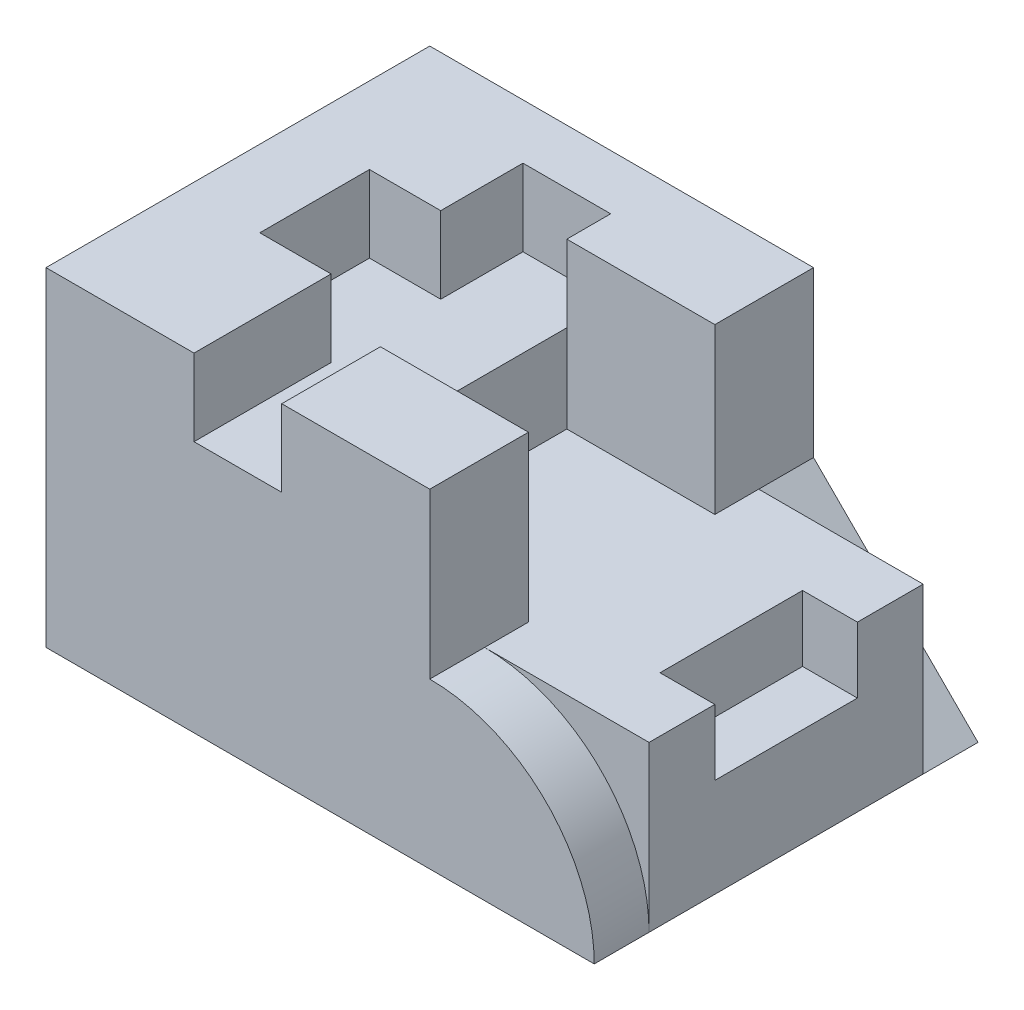
from build123d import *

# Parameters (mm, degrees)
SKETCH_1_W          = 50
SKETCH_1_H          = 30
EXTRUDE_1_DEPTH     = 35
SKETCH_2_W          = 15
SKETCH_2_H          = 15
CUT_EXTRUDE_1_DEPTH = 46.552167896
SKETCH_3_W          = 13.5
SKETCH_3_H          = 10
CUT_EXTRUDE_2_DEPTH = 15
SKETCH_3_3_W        = 8
SKETCH_3_3_H        = 12.5
SKETCH_3_3_H_2      = 10
SKETCH_3_3_H_3      = 7.5
SKETCH_3_3_W_2      = 6.5
CUT_EXTRUDE_3_DEPTH = 7
SKETCH_6_W          = 5
SKETCH_6_H          = 13
CUT_EXTRUDE_4_DEPTH = 6
CUT_EXTRUDE_5_REACH = 54.44
SKETCH_7_W          = 13.5
SKETCH_7_H          = 17
CUT_EXTRUDE_6_DEPTH = 5
CUT_EXTRUDE_7_DEPTH = 5


with BuildPart() as part:
    # Эскиз1 → Бобышка-Вытянуть1 (new body)
    with BuildSketch(Plane.XY):
        Rectangle(SKETCH_1_W, SKETCH_1_H)
    extrude(amount=EXTRUDE_1_DEPTH)

    # Эскиз2 → Вырез-Вытянуть1 (cut, through all)
    with BuildSketch(Plane.XY.offset(35)):
        with Locations((17.5, 7.5)):
            Rectangle(SKETCH_2_W, SKETCH_2_H)
    extrude(amount=-CUT_EXTRUDE_1_DEPTH, mode=Mode.SUBTRACT)

    # Эскиз3 → Вырез-Вытянуть2 (cut)
    with BuildSketch(Plane(origin=(0, 15, 0), x_dir=(1, 0, 0), z_dir=(0, 1, 0))):
        with Locations((3.25, -17.5)):
            Rectangle(SKETCH_3_W, SKETCH_3_H)
    extrude(amount=-CUT_EXTRUDE_2_DEPTH, mode=Mode.SUBTRACT)

    # Эскиз3<3> → Вырез-Вытянуть3 (cut)
    with BuildSketch(Plane(origin=(0, 15, 0), x_dir=(1, 0, 0), z_dir=(0, 1, 0))):
        with Locations((-7.5, -28.75)):
            Rectangle(SKETCH_3_3_W, SKETCH_3_3_H)
        with Locations((-7.5, -17.5)):
            Rectangle(SKETCH_3_3_W, SKETCH_3_3_H_2)
        with Locations((-7.5, -8.75)):
            Rectangle(SKETCH_3_3_W, SKETCH_3_3_H_3)
        with Locations((-14.75, -17.5)):
            Rectangle(SKETCH_3_3_W_2, SKETCH_3_3_H_2)
    extrude(amount=-CUT_EXTRUDE_3_DEPTH, mode=Mode.SUBTRACT)

    # Эскиз6 → Вырез-Вытянуть4 (cut)
    with BuildSketch(Plane(origin=(0, 0, 0), x_dir=(1, 0, 0), z_dir=(0, 1, 0))):
        with Locations((22.5, -17.5)):
            Rectangle(SKETCH_6_W, SKETCH_6_H)
    extrude(amount=-CUT_EXTRUDE_4_DEPTH, mode=Mode.SUBTRACT)

    # Вырез-Вытянуть5: up to this face of the body (flat: up to its plane)
    cut_extrude_5_end = Plane(part.part.faces().sort_by_distance((13.720588235, 0, 17.5))[0])
    # Эскиз7 → Вырез-Вытянуть5 (cut, up to the picked face)
    with BuildSketch(Plane(origin=(0, 15, 0), x_dir=(1, 0, 0), z_dir=(0, 1, 0)), mode=Mode.PRIVATE) as cut_extrude_5_sk1:
        with Locations((3.25, -17.5)):
            Rectangle(SKETCH_7_W, SKETCH_7_H)
    cut_extrude_5_tool1 = split(extrude(cut_extrude_5_sk1.sketch, amount=-CUT_EXTRUDE_5_REACH, mode=Mode.PRIVATE), bisect_by=cut_extrude_5_end, keep=Keep.BOTH, mode=Mode.PRIVATE)
    add(cut_extrude_5_tool1.solids().sort_by(Axis((3.25, 15, 17.5), (0, -1, 0)))[0], mode=Mode.SUBTRACT)

    # Эскиз8 → Вырез-Вытянуть6 (cut)
    with BuildSketch(Plane.XY.offset(35)):
        with BuildLine():
            Line((25, 0), (10, 0))
            ThreePointArc((10, 0), (20.606601718, -4.393398282), (25, -15))
            Line((25, -15), (25, 0))
        make_face()
    extrude(amount=-CUT_EXTRUDE_6_DEPTH, mode=Mode.SUBTRACT)

    # Эскиз9 → Вырез-Вытянуть7 (cut)
    with BuildSketch(Plane(origin=(0, 0, 0), x_dir=(-1, 0, 0), z_dir=(0, 0, -1))):
        Polygon((-25, -15), (-10, 0), (-25, 0), align=None)
    extrude(amount=-CUT_EXTRUDE_7_DEPTH, mode=Mode.SUBTRACT)


solid = part.part
